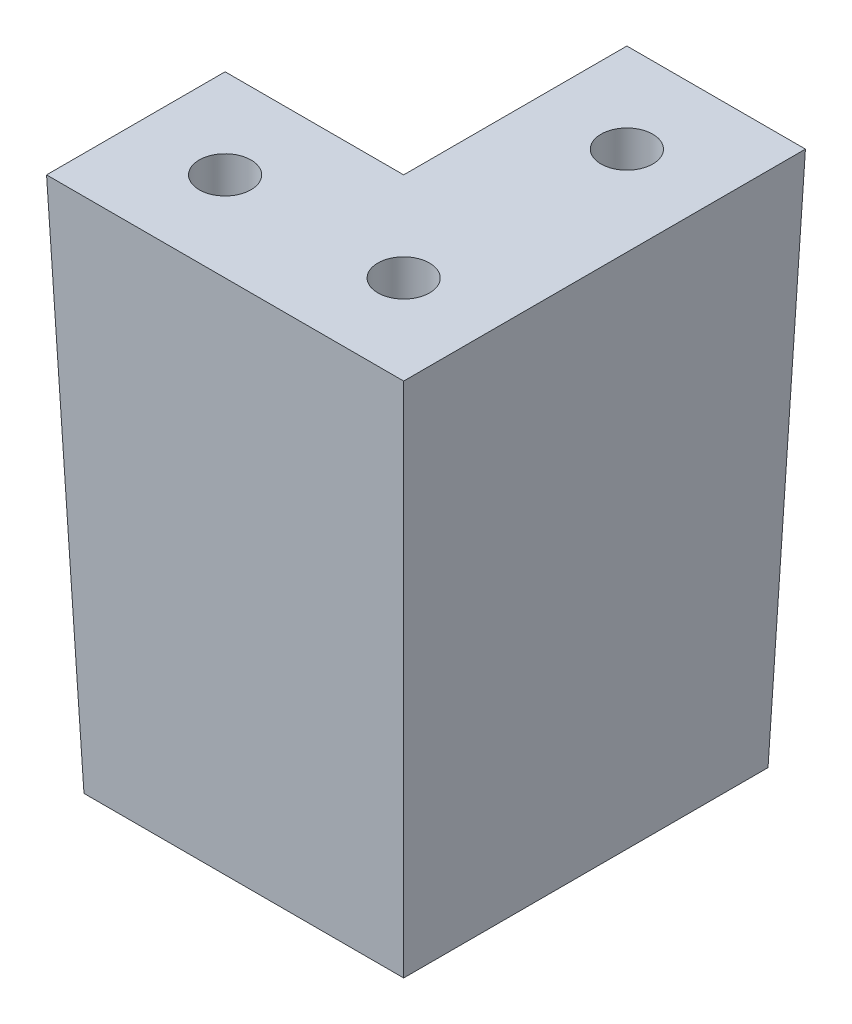
from build123d import *

# Parameters (mm, degrees)
BOSS_EXTRUDE1_DEPTH             = 60
BOSS_EXTRUDE1_DRAFT             = -2
CBORE_FOR_M5_SBHCS1_D           = 5.8
CBORE_FOR_M5_SBHCS1_CBORE_D     = 11.5
CBORE_FOR_M5_SBHCS1_CBORE_DEPTH = 55


with BuildPart() as part:
    # Sketch1 → Boss-Extrude1 (with draft: the straight prism first)
    with BuildSketch(Plane(origin=(0, 0, 0), x_dir=(1, 0, 0), z_dir=(0, 1, 0))):
        Polygon((0, 0), (40, 0), (40, 45), (20, 45), (20, 20), (0, 20), align=None)
    extrude(amount=-BOSS_EXTRUDE1_DEPTH)
    # Boss-Extrude1: the draft: its side faces are tilted about the plane it starts from
    boss_extrude1_sides = [part.faces().sort_by_distance(p)[0] for p in [
        (20, -30, 0),
        (40, -30, -22.5),
        (30, -30, -45),
        (20, -30, -32.5),
        (10, -30, -20),
        (0, -30, -10),
    ]]
    draft(boss_extrude1_sides, Plane(origin=(0, 0, 0), x_dir=(1, 0, 0), z_dir=(0, 1, 0)), BOSS_EXTRUDE1_DRAFT)

    # CBORE for M5 SBHCS1 (through all)
    with Locations(Plane(origin=(0, -60, 0), x_dir=(-1, 0, 0), z_dir=(0, -1, 0))):
        with Locations((-30, 10), (-10, 10), (-30.000000001, 35)):
            CounterBoreHole(CBORE_FOR_M5_SBHCS1_D / 2, CBORE_FOR_M5_SBHCS1_CBORE_D / 2, CBORE_FOR_M5_SBHCS1_CBORE_DEPTH)


solid = part.part
